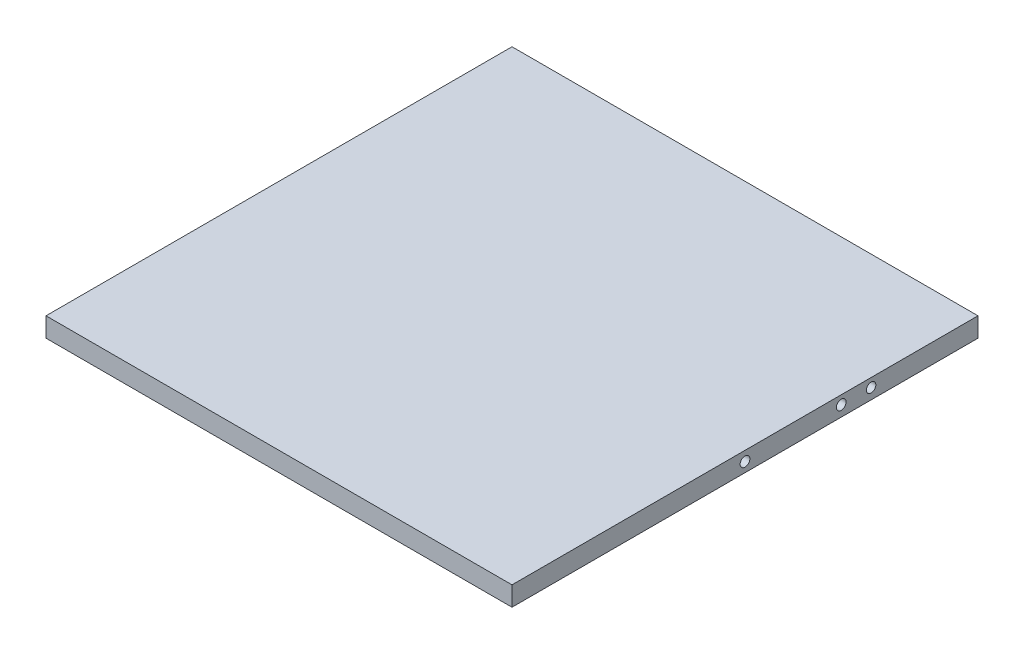
from build123d import *

# Parameters (mm, degrees)
SKETCH2_W               = 304.8
SKETCH2_H               = 304.8
BOSS_EXTRUDE1_DEPTH     = 12.7
SKETCH3_R               = 3.175
CUT_EXTRUDE1_DEPTH      = 343.16151121
SKETCH4_R               = 3.175
CUT_EXTRUDE2_DEPTH      = 358.845553564
CUT_EXTRUDE3_DEPTH      = 343.16151121
CUT_EXTRUDE3_DEPTH_BACK = 343.16151121
SKETCH8_R               = 3.089580747
SCALE1_SCALE            = 1.5


with BuildPart() as part:
    # Sketch2 → Boss-Extrude1 (new body)
    with BuildSketch(Plane(origin=(0, 0, 0), x_dir=(1, 0, 0), z_dir=(0, 1, 0))):
        with Locations((-98.440191388, 2.55215311)):
            Rectangle(SKETCH2_W, SKETCH2_H)
    extrude(amount=BOSS_EXTRUDE1_DEPTH)

    # Sketch3 → Cut-Extrude1 (cut, through all)
    with BuildSketch(Plane(origin=(53.959808612, 0, 0), x_dir=(0, 0, -1), z_dir=(1, 0, 0))):
        with Locations((2.55215311, 6.35)):
            Circle(SKETCH3_R)
    extrude(amount=-CUT_EXTRUDE1_DEPTH, mode=Mode.SUBTRACT)

    # Sketch4 → Cut-Extrude2 (cut, through all)
    with BuildSketch(Plane(origin=(-250.840191388, 0, 32.101609765), x_dir=(0, 0, 1), z_dir=(-1, 0, 0))):
        with Locations((-97.607511841, 7.050929825)):
            Circle(SKETCH4_R)
    extrude(amount=-CUT_EXTRUDE2_DEPTH, mode=Mode.SUBTRACT)

    # Sketch8 → Cut-Extrude3 (cut, two sides: drawn at the far end of the back side and taken through both)
    with BuildSketch(Plane.ZY.offset(250.840191388).offset(-CUT_EXTRUDE3_DEPTH_BACK)):
        with Locations((-85.030883776, 7.028633546)):
            Circle(SKETCH8_R)
    extrude(amount=CUT_EXTRUDE3_DEPTH + CUT_EXTRUDE3_DEPTH_BACK, mode=Mode.SUBTRACT)


with BuildPart() as part_1:
    # Scale1: scaled about (-98.440191388, 6.338736644, -1.369646506)
    add(part.part.scale(SCALE1_SCALE).moved(Location((49.220095694, -3.169368322, 0.684823253))))


solid = part_1.part
